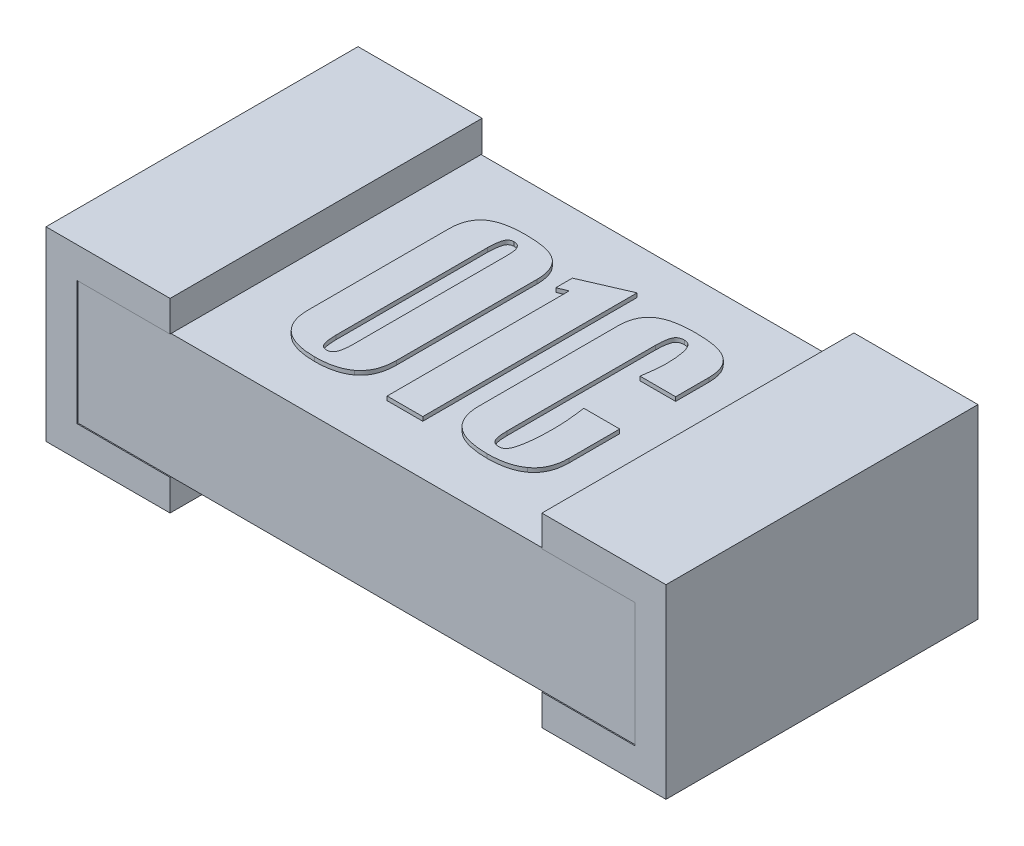
from build123d import *

# Parameters (mm, degrees)
ESBO_O1_W                = 1.372
ESBO_O1_H                = 0.305
RESSALTO_EXTRUS_O1_DEPTH = 0.381
RESSALTO_EXTRUS_O2_DEPTH = 0.3835
BOSS_EXTRUDE1_DEPTH      = 0.01


with BuildPart() as part:
    # Esboço1 → Ressalto-extrusão1 (new, symmetric)
    with BuildSketch(Plane.XY):
        Rectangle(ESBO_O1_W, ESBO_O1_H)
    extrude(amount=RESSALTO_EXTRUS_O1_DEPTH, both=True)

    # Esboço2 → Ressalto-extrusão2 (add, symmetric)
    with BuildSketch(Plane.XY):
        Polygon((-0.457, 0.1525), (-0.686, 0.1525), (-0.686, -0.1525), (-0.457, -0.1525), (-0.457, -0.2285), (-0.762, -0.2285), (-0.762, 0.2285), (-0.457, 0.2285), align=None)
    ressalto_extrus_o2 = extrude(amount=RESSALTO_EXTRUS_O2_DEPTH, both=True)

    # Espelhar1: Ressalto-extrusão2 across plane
    add(ressalto_extrus_o2.mirror(Plane(origin=(0, 0, 0), x_dir=(0, 0, 1), z_dir=(1, 0, 0))))

    # Sketch1 → Boss-Extrude1 (add)
    # profile 1 of 3: a face of its own
    with BuildSketch(Plane(origin=(0, 0.1525, 0), x_dir=(1, 0, 0), z_dir=(0, 1, 0))):
        with BuildLine():
            add(Edge.make_bspline(
                [(-0.220865644, -0.264307424), (-0.224910354, -0.264223769), (-0.232766904, -0.264061275), (-0.244200196, -0.263198042), (-0.254925716, -0.261544323), (-0.264941282, -0.259255506), (-0.274324655, -0.256499171), (-0.282931507, -0.252875074), (-0.290932302, -0.248753156), (-0.295748552, -0.245362028), (-0.298115855, -0.243695207)],
                knots=[0, 0, 0, 0, 1.193951868, 2.319163416, 3.381358812, 4.393562112, 5.350147128, 6.263325973, 7.146382828, 8, 8, 8, 8], degree=3))
            add(Edge.make_bspline(
                [(-0.298115855, -0.243695207), (-0.300543863, -0.241688157), (-0.305364706, -0.237703131), (-0.311593747, -0.230652766), (-0.31697202, -0.22289203), (-0.321112643, -0.214158141), (-0.324554983, -0.204744034), (-0.326838475, -0.194470366), (-0.328369119, -0.183455226), (-0.328507002, -0.175844734), (-0.328578157, -0.171917266)],
                knots=[0, 0, 0, 0, 0.932672121, 1.851832898, 2.77930806, 3.722546587, 4.708978169, 5.745290204, 6.836435393, 8, 8, 8, 8], degree=3))
            Line((-0.328578157, -0.171917266), (-0.328578157, 0.173382966))
            add(Edge.make_bspline(
                [(-0.328578157, 0.173382966), (-0.328514637, 0.177189755), (-0.328391587, 0.184564127), (-0.326767189, 0.195159202), (-0.324377553, 0.20491895), (-0.320870222, 0.213777674), (-0.316413729, 0.221801868), (-0.310835536, 0.228856333), (-0.304440834, 0.235241412), (-0.299397119, 0.23855516), (-0.296838992, 0.240235863)],
                knots=[0, 0, 0, 0, 1.176764232, 2.2795843, 3.308520957, 4.279725915, 5.218973025, 6.137212485, 7.055211007, 8, 8, 8, 8], degree=3))
            add(Edge.make_bspline(
                [(-0.296838992, 0.240235863), (-0.29463747, 0.241426504), (-0.29008601, 0.243888052), (-0.282631897, 0.247019451), (-0.274300502, 0.249509863), (-0.265187338, 0.251591883), (-0.255257989, 0.253224961), (-0.244543216, 0.254409606), (-0.232971973, 0.254999495), (-0.22500078, 0.255127169), (-0.220865644, 0.255193401)],
                knots=[0, 0, 0, 0, 0.766994692, 1.585697107, 2.473028251, 3.429330955, 4.449742087, 5.556120127, 6.732212792, 8, 8, 8, 8], degree=3))
            add(Edge.make_bspline(
                [(-0.220865644, 0.255193401), (-0.216668679, 0.255179303), (-0.208541339, 0.255152003), (-0.19677209, 0.254349866), (-0.185867016, 0.253332322), (-0.175847971, 0.251774808), (-0.166700263, 0.249792381), (-0.15840185, 0.247347754), (-0.150938895, 0.24449653), (-0.146480515, 0.242047375), (-0.14434507, 0.240874295)],
                knots=[0, 0, 0, 0, 1.27991872, 2.478537118, 3.59694349, 4.620007928, 5.569565292, 6.449843793, 7.257516658, 8, 8, 8, 8], degree=3))
            add(Edge.make_bspline(
                [(-0.14434507, 0.240874295), (-0.141794236, 0.239217983), (-0.136785973, 0.235966009), (-0.130287449, 0.229768595), (-0.124810213, 0.222718118), (-0.120263653, 0.214746311), (-0.116814842, 0.205824038), (-0.114425249, 0.196009378), (-0.112782453, 0.185324649), (-0.112666316, 0.177889158), (-0.112605904, 0.174021397)],
                knots=[0, 0, 0, 0, 0.938206784, 1.842058803, 2.759143239, 3.689034601, 4.667759329, 5.704508374, 6.805941241, 8, 8, 8, 8], degree=3))
            Line((-0.112605904, 0.174021397), (-0.112605904, -0.171917266))
            add(Edge.make_bspline(
                [(-0.112605904, -0.171917266), (-0.112678111, -0.175844331), (-0.112818032, -0.183454042), (-0.11433436, -0.194474671), (-0.116665842, -0.204719156), (-0.119933098, -0.214203804), (-0.124238362, -0.222865081), (-0.129581417, -0.230656906), (-0.135821609, -0.237702082), (-0.140640953, -0.241687805), (-0.143068207, -0.243695207)],
                knots=[0, 0, 0, 0, 1.16342124, 2.254431984, 3.29061633, 4.27391624, 5.22103439, 6.148395274, 7.067442798, 8, 8, 8, 8], degree=3))
            add(Edge.make_bspline(
                [(-0.143068207, -0.243695207), (-0.145435799, -0.245361374), (-0.150252638, -0.248751172), (-0.158273879, -0.252896381), (-0.16695351, -0.256497564), (-0.176398671, -0.259240511), (-0.186497766, -0.261567222), (-0.197320497, -0.263187194), (-0.208872911, -0.264063449), (-0.216790413, -0.264224519), (-0.220865644, -0.264307424)],
                knots=[0, 0, 0, 0, 0.848047861, 1.725343329, 2.64080456, 3.599681232, 4.605280548, 5.678170859, 6.80492743, 8, 8, 8, 8], degree=3))
        make_face()
        with BuildLine():
            add(Edge.make_bspline(
                [(-0.220865644, 0.226007962), (-0.222818188, 0.225882715), (-0.226514173, 0.225645633), (-0.231418266, 0.222919592), (-0.23518664, 0.218635413), (-0.237423653, 0.212745173), (-0.238950541, 0.205937315), (-0.240142272, 0.198314541), (-0.240858157, 0.189935079), (-0.240965842, 0.184085801), (-0.241021839, 0.181044144)],
                knots=[0, 0, 0, 0, 0.846643026, 1.602617004, 2.384825473, 3.296687919, 4.322800017, 5.440470164, 6.669030301, 8, 8, 8, 8], degree=3))
            Line((-0.241021839, 0.181044144), (-0.241021839, 0.171558876))
            Line((-0.241021839, 0.171558876), (-0.241021839, -0.170549199))
            add(Edge.make_bspline(
                [(-0.241021839, -0.170549199), (-0.241021839, -0.174531795), (-0.241021839, -0.181706549), (-0.241021839, -0.188881303), (-0.241021839, -0.192073461)],
                knots=[0, 0, 0, 0, 1.110169492, 2, 2, 2, 2], degree=3))
            add(Edge.make_bspline(
                [(-0.241021839, -0.192073461), (-0.240968791, -0.195176063), (-0.240868255, -0.201056147), (-0.240139502, -0.209405206), (-0.238996939, -0.216800319), (-0.237390081, -0.223218341), (-0.234913999, -0.228550083), (-0.231185908, -0.232442903), (-0.226322597, -0.234779161), (-0.222746387, -0.23500383), (-0.220865644, -0.235121984)],
                knots=[0, 0, 0, 0, 1.399243913, 2.651861955, 3.776759643, 4.771339463, 5.629855724, 6.395897363, 7.156396381, 8, 8, 8, 8], degree=3))
            add(Edge.make_bspline(
                [(-0.220865644, -0.235121984), (-0.21894465, -0.235025475), (-0.21529189, -0.234841962), (-0.210439512, -0.232201187), (-0.206585181, -0.228194495), (-0.204213891, -0.222530761), (-0.202355235, -0.216000136), (-0.20114402, -0.208493189), (-0.200295949, -0.200240869), (-0.200207969, -0.194447372), (-0.200162223, -0.191435029)],
                knots=[0, 0, 0, 0, 0.846459692, 1.609538252, 2.39487695, 3.279154343, 4.307684219, 5.420711897, 6.658892756, 8, 8, 8, 8], degree=3))
            add(Edge.make_bspline(
                [(-0.200162223, -0.191435029), (-0.200162223, -0.18921572), (-0.200162223, -0.185081116), (-0.200162223, -0.179274429), (-0.200162223, -0.174318985), (-0.200162223, -0.171278835), (-0.200162223, -0.169910767)],
                knots=[0, 0, 0, 0, 1.237288136, 2.305084746, 3.237288136, 4, 4, 4, 4], degree=3))
            Line((-0.200162223, -0.169910767), (-0.200162223, 0.17529826))
            Line((-0.200162223, 0.17529826), (-0.200162223, 0.186060391))
            add(Edge.make_bspline(
                [(-0.200162223, 0.186060391), (-0.200203209, 0.189009883), (-0.200278478, 0.194426516), (-0.200656043, 0.201834873), (-0.201494398, 0.207803487), (-0.202472562, 0.211209474), (-0.202898358, 0.212692105)],
                knots=[0, 0, 0, 0, 1.317164877, 2.418924811, 3.31175562, 4, 4, 4, 4], degree=3))
            add(Edge.make_bspline(
                [(-0.202898358, 0.212692105), (-0.203793967, 0.214700061), (-0.205472762, 0.218463925), (-0.209563312, 0.222982137), (-0.214923884, 0.225602209), (-0.218830669, 0.225868997), (-0.220865644, 0.226007962)],
                knots=[0, 0, 0, 0, 1.095763048, 2.053980037, 2.986352427, 4, 4, 4, 4], degree=3))
        make_face(mode=Mode.SUBTRACT)
    # profile 2 of 3: a face of its own
    with BuildSketch(Plane(origin=(0, 0.1525, 0), x_dir=(1, 0, 0), z_dir=(0, 1, 0))):
        Polygon((-0.048397937, -0.258470336), (-0.048397937, 0.189161344), (-0.071746289, 0.179311258), (-0.071746289, 0.220170874), (0.039158382, 0.268326849), (0.039158382, -0.258470336), align=None)
    # profile 3 of 3: a face of its own
    with BuildSketch(Plane(origin=(0, 0.1525, 0), x_dir=(1, 0, 0), z_dir=(0, 1, 0))):
        with BuildLine():
            add(Edge.make_bspline(
                [(0.196759755, -0.258470336), (0.192531481, -0.258438742), (0.184335496, -0.258377502), (0.172433891, -0.257309226), (0.161291276, -0.255773949), (0.150862198, -0.253761817), (0.14127562, -0.250894404), (0.13244171, -0.247528644), (0.124335524, -0.243552133), (0.1194469, -0.240283544), (0.117047024, -0.23867896)],
                knots=[0, 0, 0, 0, 1.216118788, 2.357294728, 3.434741439, 4.451993803, 5.409622622, 6.309545934, 7.170138815, 8, 8, 8, 8], degree=3))
            add(Edge.make_bspline(
                [(0.117047024, -0.23867896), (0.114559867, -0.236704299), (0.10961, -0.232774388), (0.103185476, -0.225791195), (0.097893224, -0.217930385), (0.093445251, -0.209343905), (0.090006533, -0.199933509), (0.087542383, -0.189686191), (0.086080914, -0.178648161), (0.085931756, -0.171009746), (0.085855085, -0.167083428)],
                knots=[0, 0, 0, 0, 0.937551665, 1.865888308, 2.79043465, 3.730737504, 4.717127794, 5.743503742, 6.840109746, 8, 8, 8, 8], degree=3))
            Line((0.085855085, -0.167083428), (0.085855085, 0.174295011))
            add(Edge.make_bspline(
                [(0.085855085, 0.174295011), (0.085972255, 0.178098863), (0.086199063, 0.185462012), (0.087589932, 0.19606858), (0.090187558, 0.205763915), (0.093689772, 0.214575491), (0.098342153, 0.222448721), (0.103936689, 0.229475735), (0.110643634, 0.235552856), (0.115749123, 0.238787167), (0.118323887, 0.240418272)],
                knots=[0, 0, 0, 0, 1.179023306, 2.282245646, 3.306055267, 4.2822897, 5.211378982, 6.129512547, 7.056689137, 8, 8, 8, 8], degree=3))
            add(Edge.make_bspline(
                [(0.118323887, 0.240418272), (0.120582316, 0.241619763), (0.125264972, 0.244110949), (0.132991943, 0.247061566), (0.141526052, 0.249618405), (0.150911045, 0.251714843), (0.161193272, 0.253187732), (0.172290768, 0.254423826), (0.184259005, 0.254993506), (0.192503216, 0.255125336), (0.196759755, 0.255193401)],
                knots=[0, 0, 0, 0, 0.760726154, 1.577298939, 2.456067021, 3.410956183, 4.435931611, 5.546028506, 6.732998642, 8, 8, 8, 8], degree=3))
            add(Edge.make_bspline(
                [(0.196759755, 0.255193401), (0.201017301, 0.25517782), (0.209265707, 0.255147632), (0.221189743, 0.254366465), (0.232233205, 0.253287553), (0.242424801, 0.251899436), (0.25170204, 0.249867133), (0.260155172, 0.247516163), (0.267769787, 0.244767189), (0.272359579, 0.242381427), (0.274557193, 0.241239113)],
                knots=[0, 0, 0, 0, 1.280214883, 2.480239459, 3.592025429, 4.617438986, 5.571518523, 6.445663814, 7.255776351, 8, 8, 8, 8], degree=3))
            add(Edge.make_bspline(
                [(0.274557193, 0.241239113), (0.27719489, 0.239643769), (0.282398674, 0.236496392), (0.289207432, 0.230483093), (0.294904109, 0.223553376), (0.299613389, 0.215788367), (0.303290578, 0.20713402), (0.305788482, 0.197545012), (0.307358642, 0.187115168), (0.307560275, 0.1798644), (0.307664426, 0.176119101)],
                knots=[0, 0, 0, 0, 0.960118431, 1.894170584, 2.816986194, 3.74891769, 4.717708274, 5.739098901, 6.832158024, 8, 8, 8, 8], degree=3))
            Line((0.307664426, 0.176119101), (0.307664426, 0.094582279))
            Line((0.307664426, 0.094582279), (0.220108107, 0.094582279))
            add(Edge.make_bspline(
                [(0.220108107, 0.094582279), (0.220862392, 0.099716731), (0.222421862, 0.110332107), (0.223976567, 0.12365994), (0.224935686, 0.134221488), (0.225470608, 0.141305857), (0.22589864, 0.147414949), (0.225930639, 0.151158896), (0.225945195, 0.152861954)],
                knots=[0, 0, 0, 0, 1.593719065, 3.294982131, 4.119992208, 4.850399435, 5.477066324, 6, 6, 6, 6], degree=3))
            add(Edge.make_bspline(
                [(0.225945195, 0.152861954), (0.225881038, 0.157910463), (0.225758355, 0.167564434), (0.224679507, 0.181368554), (0.222865643, 0.193799235), (0.220830813, 0.203264983), (0.21857393, 0.209938903), (0.21673973, 0.214257293), (0.214407584, 0.217844594), (0.211847472, 0.220898781), (0.208805394, 0.223127293), (0.205548603, 0.224888406), (0.201880495, 0.225765611), (0.199347496, 0.225925313), (0.198036618, 0.226007962)],
                knots=[0, 0, 0, 0, 2.120471513, 4.054853942, 5.810282857, 7.396311017, 8.111101077, 8.768488279, 9.360067847, 9.90306496, 10.43175815, 10.934359924, 11.448509894, 12, 12, 12, 12], degree=3))
            add(Edge.make_bspline(
                [(0.198036618, 0.226007962), (0.195547442, 0.225885181), (0.190936706, 0.225657753), (0.184710366, 0.22310198), (0.180000113, 0.218754642), (0.177312009, 0.212651379), (0.175634196, 0.205617307), (0.174378708, 0.197617098), (0.173544883, 0.188692486), (0.173457259, 0.182414335), (0.173411404, 0.179128849)],
                knots=[0, 0, 0, 0, 0.986219356, 1.826787147, 2.622979275, 3.472643917, 4.435345385, 5.501683213, 6.692579384, 8, 8, 8, 8], degree=3))
            Line((0.173411404, 0.179128849), (0.173411404, 0.172197307))
            Line((0.173411404, 0.172197307), (0.173411404, -0.161702363))
            add(Edge.make_bspline(
                [(0.173411404, -0.161702363), (0.173411404, -0.163952074), (0.173411404, -0.168360291), (0.173411404, -0.174744606), (0.173411404, -0.180642497), (0.173411404, -0.184381881), (0.173411404, -0.186145168)],
                knots=[0, 0, 0, 0, 1.104477612, 2.164179104, 3.134328358, 4, 4, 4, 4], degree=3))
            add(Edge.make_bspline(
                [(0.173411404, -0.186145168), (0.173446029, -0.189400885), (0.173510912, -0.195501531), (0.174447046, -0.204102137), (0.175855094, -0.211533084), (0.177735752, -0.217917641), (0.180738537, -0.223161488), (0.185338851, -0.226800206), (0.191175587, -0.228936334), (0.195463189, -0.229163205), (0.197763005, -0.229284896)],
                knots=[0, 0, 0, 0, 1.381327158, 2.58836629, 3.666493117, 4.5887833, 5.405447282, 6.185397669, 7.026670002, 8, 8, 8, 8], degree=3))
            add(Edge.make_bspline(
                [(0.197763005, -0.229284896), (0.19902141, -0.22919611), (0.201552888, -0.229017501), (0.205134697, -0.227597482), (0.20839138, -0.225265596), (0.211278114, -0.222043413), (0.21381508, -0.217897459), (0.216234583, -0.21298994), (0.218038461, -0.207049205), (0.220432608, -0.197796093), (0.222600426, -0.184655844), (0.224614977, -0.167433204), (0.225777781, -0.148310907), (0.225887671, -0.134950516), (0.225945195, -0.127956698)],
                knots=[0, 0, 0, 0, 0.403505833, 0.811714689, 1.218283676, 1.681575921, 2.191076587, 2.776578701, 3.434607184, 4.18097886, 5.848171616, 7.707022616, 9.752737487, 12, 12, 12, 12], degree=3))
            add(Edge.make_bspline(
                [(0.225945195, -0.127956698), (0.225891608, -0.123153405), (0.225788827, -0.113940703), (0.225526181, -0.100673512), (0.224649086, -0.088605928), (0.223635793, -0.077632973), (0.222534927, -0.067694385), (0.221414328, -0.058641411), (0.220425304, -0.050461647), (0.219775514, -0.045294796), (0.219469676, -0.042862901)],
                knots=[0, 0, 0, 0, 1.349735508, 2.588788794, 3.727465691, 4.74829072, 5.68498817, 6.536830445, 7.311326338, 8, 8, 8, 8], degree=3))
            Line((0.219469676, -0.042862901), (0.307664426, -0.042862901))
            Line((0.307664426, -0.042862901), (0.307664426, -0.167265837))
            add(Edge.make_bspline(
                [(0.307664426, -0.167265837), (0.307587529, -0.171131201), (0.307437987, -0.178648205), (0.305977226, -0.189537506), (0.30348247, -0.199638346), (0.30018645, -0.209046437), (0.295626798, -0.21752336), (0.290340112, -0.225344959), (0.283878657, -0.23222872), (0.27895516, -0.236152943), (0.276472487, -0.238131733)],
                knots=[0, 0, 0, 0, 1.151413851, 2.239163268, 3.265258838, 4.248216884, 5.200514176, 6.125266155, 7.054665715, 8, 8, 8, 8], degree=3))
            add(Edge.make_bspline(
                [(0.276472487, -0.238131733), (0.27403861, -0.239759456), (0.269071482, -0.243081361), (0.260922434, -0.247269217), (0.252012608, -0.250722297), (0.242358773, -0.253522049), (0.232010432, -0.255830769), (0.220869751, -0.257297356), (0.209063175, -0.258376291), (0.200927485, -0.258438479), (0.196759755, -0.258470336)],
                knots=[0, 0, 0, 0, 0.840201828, 1.714707987, 2.624067914, 3.579716116, 4.598460921, 5.665034483, 6.803850184, 8, 8, 8, 8], degree=3))
        make_face()
    extrude(amount=BOSS_EXTRUDE1_DEPTH)


solid = part.part
